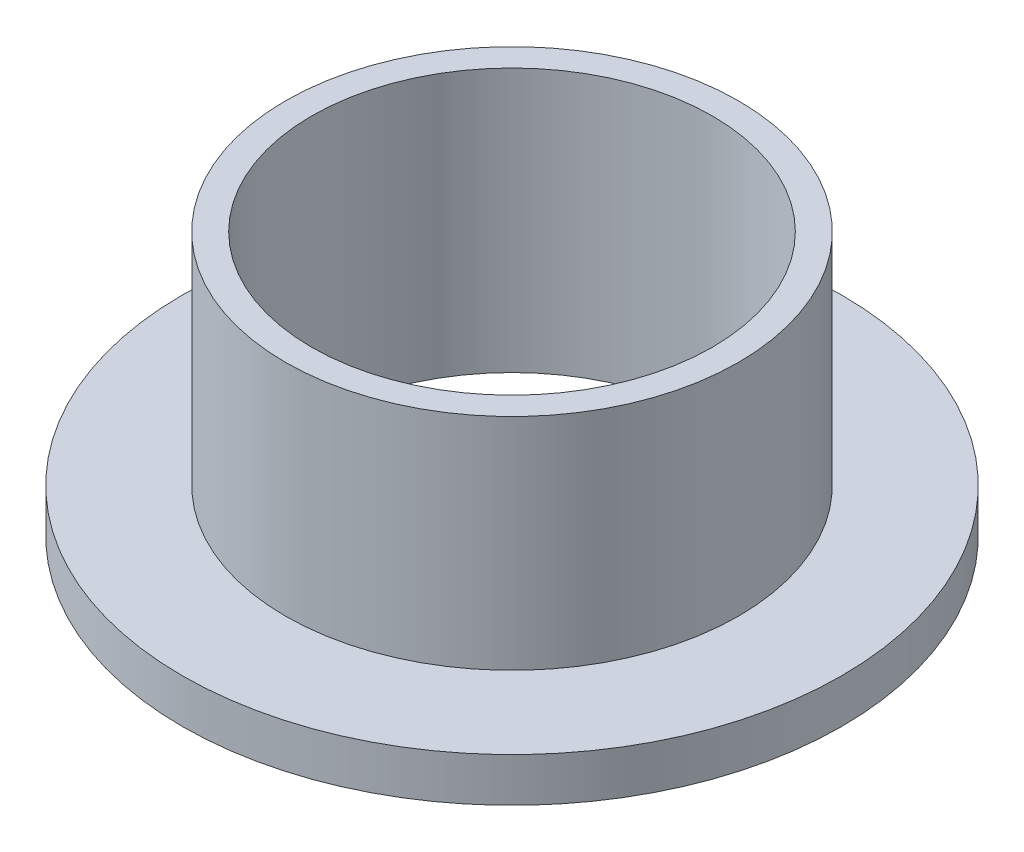
from build123d import *

# Parameters (mm, degrees)
SKETCH1_R           = 30
BOSS_EXTRUDE1_DEPTH = 4
SKETCH1_3_R         = 20.610704172
BOSS_EXTRUDE2_DEPTH = 24
SKETCH1_6_R         = 18.231835924
CUT_EXTRUDE1_DEPTH  = 49.744230428


with BuildPart() as part:
    # Sketch1 → Boss-Extrude1 (new body)
    with BuildSketch(Plane(origin=(0, 0, 0), x_dir=(1, 0, 0), z_dir=(0, 1, 0))):
        Circle(SKETCH1_R)
    extrude(amount=BOSS_EXTRUDE1_DEPTH)

    # Sketch1<3> → Boss-Extrude2 (add)
    with BuildSketch(Plane(origin=(0, 0, 0), x_dir=(1, 0, 0), z_dir=(0, 1, 0))):
        Circle(SKETCH1_3_R)
    extrude(amount=BOSS_EXTRUDE2_DEPTH)

    # Sketch1<6> → Cut-Extrude1 (cut, through all)
    with BuildSketch(Plane(origin=(0, 0, 0), x_dir=(1, 0, 0), z_dir=(0, 1, 0))):
        Circle(SKETCH1_6_R)
    extrude(amount=CUT_EXTRUDE1_DEPTH, mode=Mode.SUBTRACT)


solid = part.part
